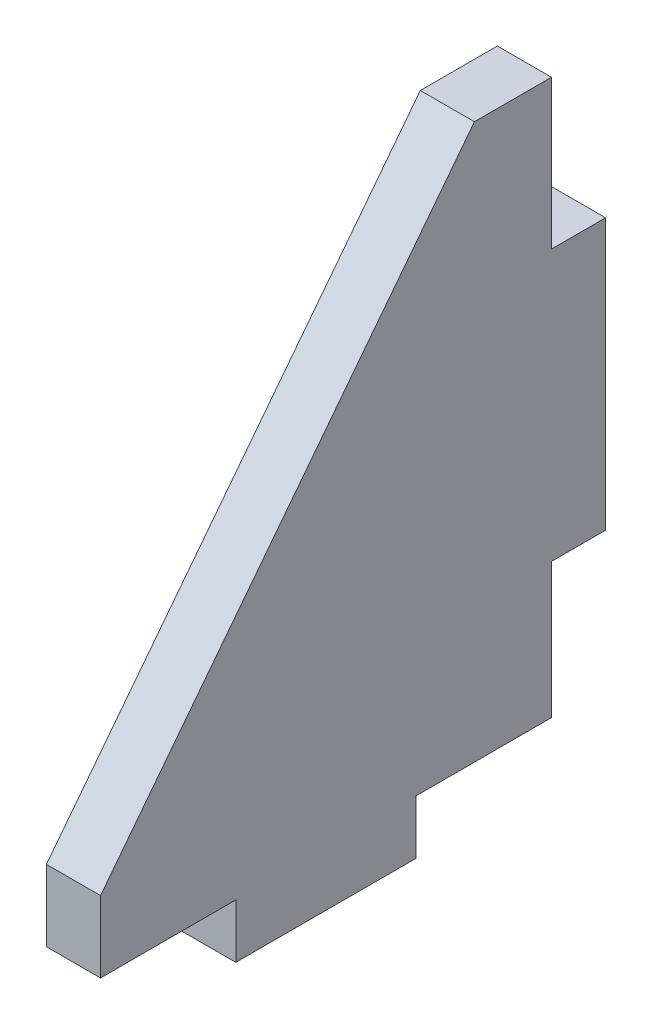
from build123d import *

# Parameters (mm, degrees)
SKETCH1_W           = 6
SKETCH1_H           = 67.498322337
BOSS_EXTRUDE1_DEPTH = 50
SKETCH1_3_W         = 6
SKETCH1_3_H         = 30
BOSS_EXTRUDE2_DEPTH = 6
CUT_EXTRUDE1_DEPTH  = 6
CUT_EXTRUDE2_DEPTH  = 6


with BuildPart() as part:
    # Sketch1 → Boss-Extrude1 (new body)
    with BuildSketch(Plane.XY):
        with Locations((3, -6.250838831)):
            Rectangle(SKETCH1_W, SKETCH1_H)
    extrude(amount=BOSS_EXTRUDE1_DEPTH)

    # Sketch1<3> → Boss-Extrude2 (add)
    with BuildSketch(Plane.XY):
        with Locations((3, -4)):
            Rectangle(SKETCH1_3_W, SKETCH1_3_H)
    extrude(amount=-BOSS_EXTRUDE2_DEPTH)

    # Sketch2 → Cut-Extrude1 (cut)
    with BuildSketch(Plane.ZY):
        Polygon((0, -34), (15, -34), (15, -40), (35, -40), (35, -34), (50, -34), (50, -43.159116413), (0, -43.159116413), align=None)
    extrude(amount=-CUT_EXTRUDE1_DEPTH, mode=Mode.SUBTRACT)

    # Sketch3 → Cut-Extrude2 (cut)
    with BuildSketch(Plane.ZY):
        Polygon((8.542523628, 27.498322337), (50, -26.085899573), (50, 27.498322337), align=None)
    extrude(amount=-CUT_EXTRUDE2_DEPTH, mode=Mode.SUBTRACT)


solid = part.part
